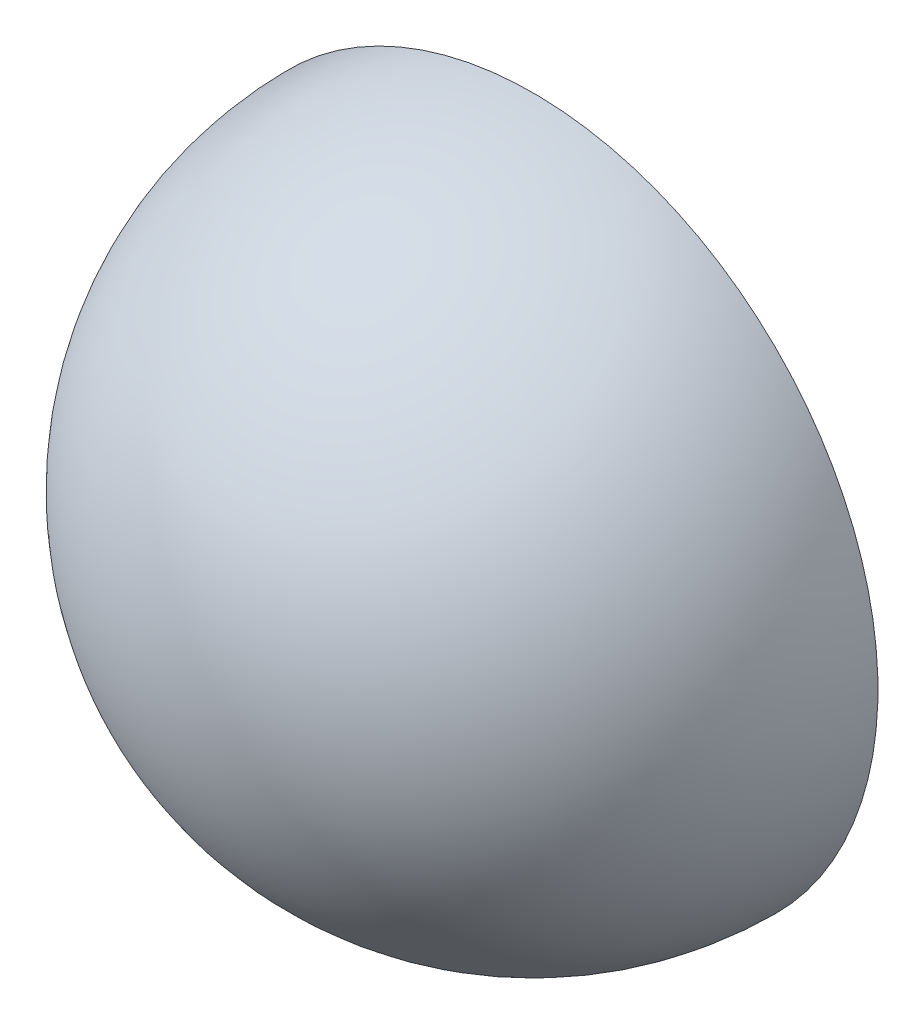
from build123d import *

# Parameters (mm, degrees)
REVOLVE4_ANGLE = 180


with BuildPart() as part:
    # Sketch2 → Revolve4 (revolve)
    with BuildSketch(Plane.XY):
        with BuildLine():
            ThreePointArc((0, -436), (436, 0), (0, 436))
            Line((0, 436), (0, 433))
            ThreePointArc((0, 433), (433, 0), (0, -433))
            Line((0, -433), (0, -436))
        make_face()
    revolve(axis=Axis((0, 436, 0), (0, -1, 0)), revolution_arc=REVOLVE4_ANGLE)


solid = part.part
